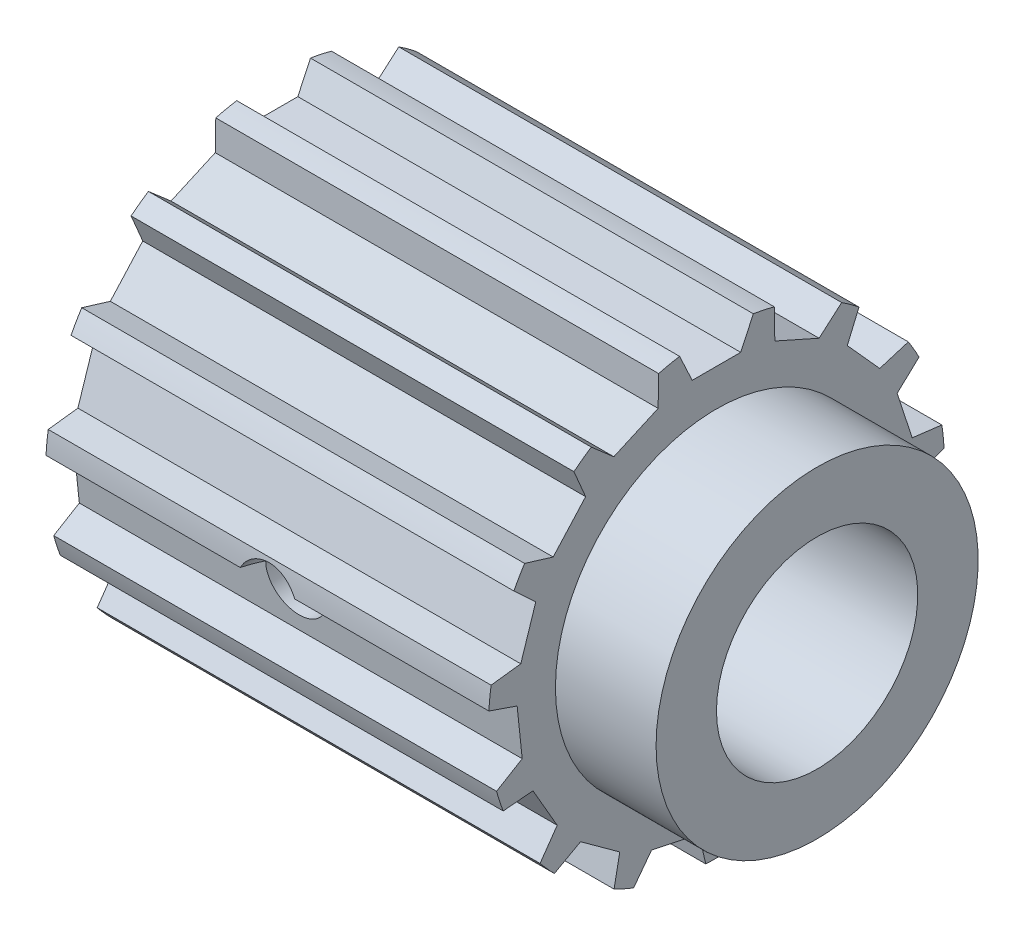
from build123d import *

# Parameters (mm, degrees)
ENL_V_MAT_EXTRU_1_DEPTH      = 32.392853486
ENL_V_MAT_EXTRU_1_DEPTH_BACK = 32.392853486
ESQUISSE2_R                  = 1.5
ENL_V_MAT_EXTRU_2_REACH      = 33.393
R_P_TITION_CIRCULAIRE1_COUNT = 15


with BuildPart() as part:
    # Esquisse1 → Révolution1 (revolve)
    with BuildSketch(Plane.XY, mode=Mode.PRIVATE) as r_volution1_sk:
        Polygon((0, 5), (0, 8), (-5, 8), (-5, 11.325), (-27, 11.325), (-27, 5), align=None)
    revolve(r_volution1_sk.sketch.rotate(Axis((-12.25475793, 0, 0), (1, 0, 0)), 90), axis=Axis((-12.25475793, 0, 0), (1, 0, 0)))

    # Esquisse2 → Enlèv. mat.-Extru.1 (cut, two sides: drawn at the far end of the back side and taken through both)
    with BuildSketch(Plane.XY.offset(-ENL_V_MAT_EXTRU_1_DEPTH_BACK)):
        with Locations((-16, 0)):
            Circle(ESQUISSE2_R)
    extrude(amount=ENL_V_MAT_EXTRU_1_DEPTH + ENL_V_MAT_EXTRU_1_DEPTH_BACK, mode=Mode.SUBTRACT)

    # Esquisse3 → Enlèv. mat.-Extru.2 (cut, up to next)
    with BuildSketch(Plane.ZY.offset(27), mode=Mode.PRIVATE) as enl_v_mat_extru_2_sk1:
        with BuildLine():
            Line((-2.16, 11.88023674), (-1.204069301, 9.83023674))
            Line((-1.204069301, 9.83023674), (1.204069301, 9.83023674))
            Line((1.204069301, 9.83023674), (2.16, 11.88023674))
            ThreePointArc((2.16, 11.88023674), (0, 12.075), (-2.16, 11.88023674))
        make_face()
    enl_v_mat_extru_2_tool1 = extrude(enl_v_mat_extru_2_sk1.sketch, amount=-ENL_V_MAT_EXTRU_2_REACH, mode=Mode.PRIVATE) & part.part
    enl_v_mat_extru_2 = enl_v_mat_extru_2_tool1.solids().sort_by_distance((-27, 11.028097, 0))[0]
    add(enl_v_mat_extru_2, mode=Mode.SUBTRACT)

    # Répétition circulaire1: Enlèv. mat.-Extru.2 ×15 about axis
    r_p_tition_circulaire1_axis = Axis((0, 0, 0), (1, 0, 0))
    for i in range(1, R_P_TITION_CIRCULAIRE1_COUNT):
        add(enl_v_mat_extru_2.rotate(r_p_tition_circulaire1_axis, i * 360 / R_P_TITION_CIRCULAIRE1_COUNT), mode=Mode.SUBTRACT)


solid = part.part
